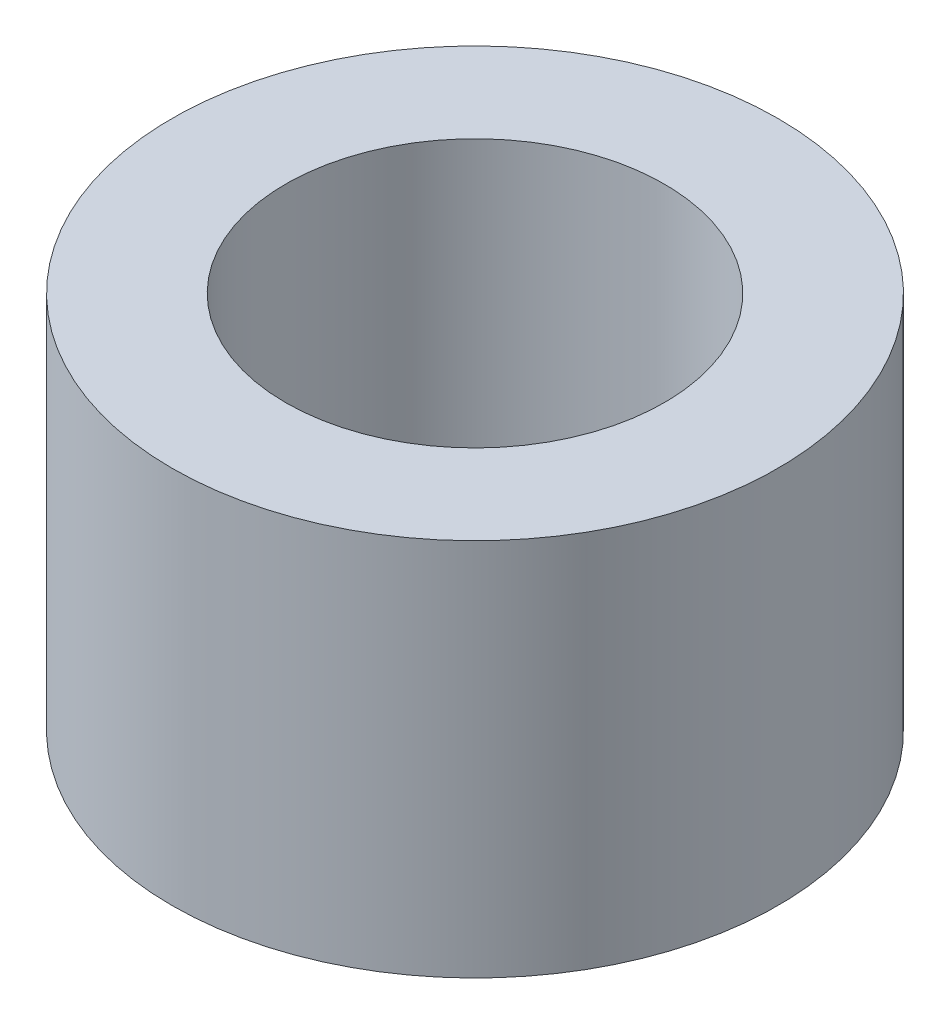
from build123d import *

# Parameters (mm, degrees)
SKETCH1_R           = 4
SKETCH1_R_2         = 2.5
BOSS_EXTRUDE1_DEPTH = 5


with BuildPart() as part:
    # Sketch1 → Boss-Extrude1 (new body)
    with BuildSketch(Plane(origin=(0, 0, 0), x_dir=(1, 0, 0), z_dir=(0, 1, 0))):
        with Locations(Location((0, 0, 0), (0, 0, 270))):
            Circle(SKETCH1_R)
        with Locations(Location((0, 0, 0), (0, 0, 270))):
            Circle(SKETCH1_R_2, mode=Mode.SUBTRACT)
    extrude(amount=BOSS_EXTRUDE1_DEPTH)


solid = part.part
